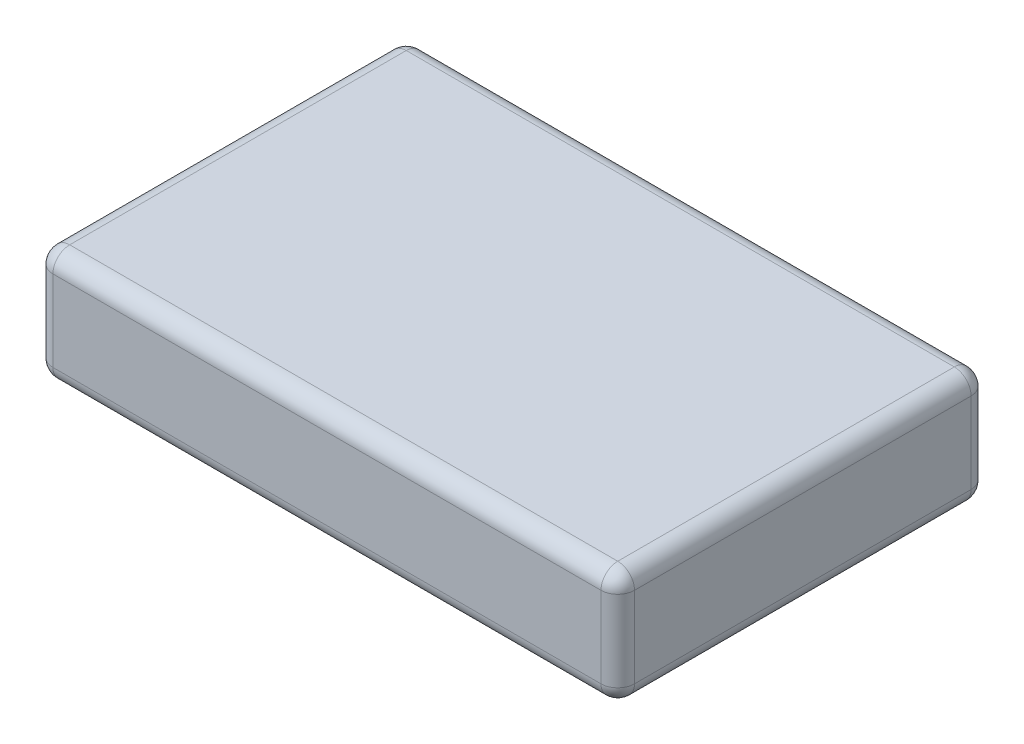
from build123d import *

# Parameters (mm, degrees)
SKETCH1_W           = 66
SKETCH1_H           = 42
BOSS_EXTRUDE1_DEPTH = 13
FILLET1_R           = 1.905


with BuildPart() as part:
    # Sketch1 → Boss-Extrude1 (new body)
    with BuildSketch(Plane(origin=(0, 0, 0), x_dir=(1, 0, 0), z_dir=(0, 1, 0))):
        Rectangle(SKETCH1_W, SKETCH1_H)
    extrude(amount=BOSS_EXTRUDE1_DEPTH)

    # Fillet1
    fillet1_edges = [part.edges().sort_by_distance(p)[0] for p in [
        (-33, 13, 0),
        (0, 13, 21),
        (33, 13, 0),
        (0, 0, 21),
        (-33, 0, 0),
        (0, 0, -21),
        (33, 0, 0),
        (0, 13, -21),
        (33, 6.5, 21),
        (-33, 6.5, 21),
        (-33, 6.5, -21),
        (33, 6.5, -21),
    ]]
    fillet(fillet1_edges, radius=FILLET1_R)


solid = part.part
